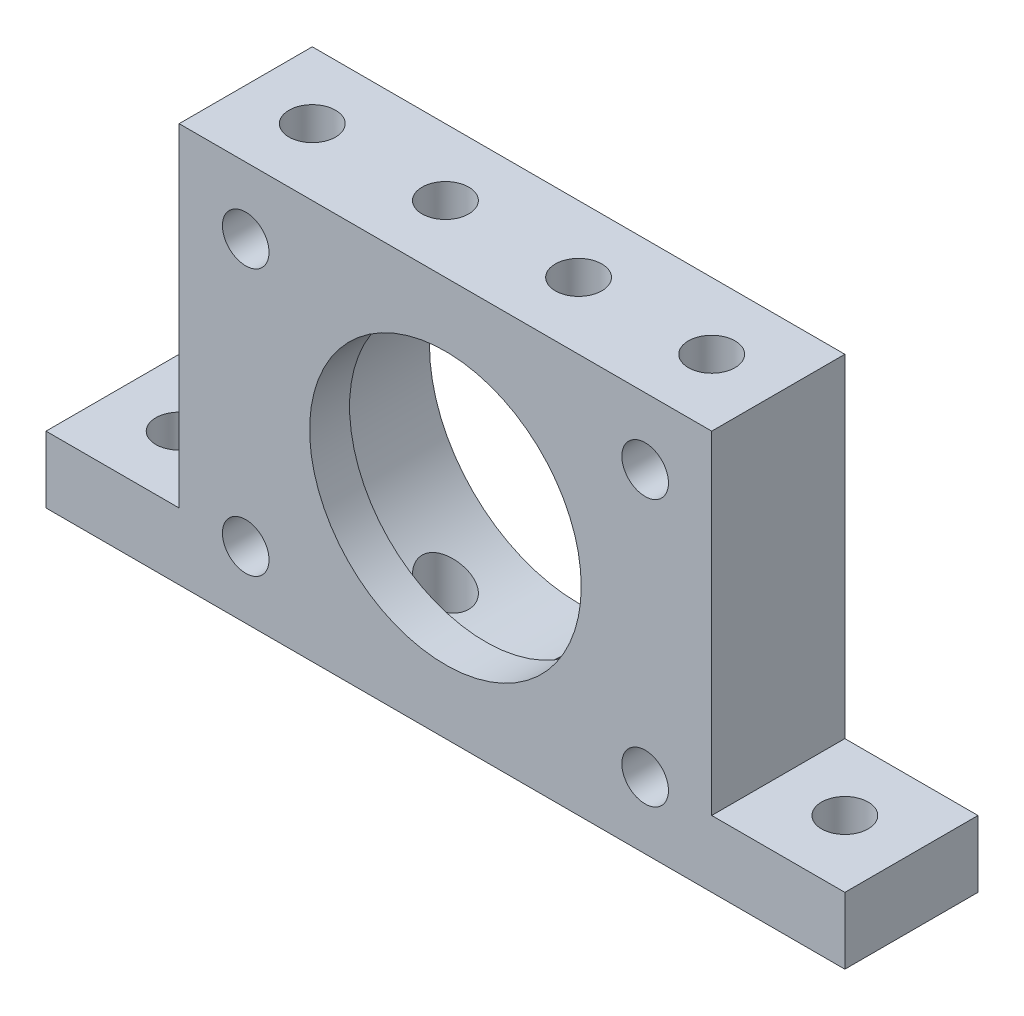
from build123d import *

# Parameters (mm, degrees)
ESQUISSE1_R             = 11.2
ESQUISSE1_R_2           = 1.75
BOSS_EXTRU_1_DEPTH      = 10
BOSS_EXTRU_2_START      = -3
ESQUISSE2_R             = 11.2
ESQUISSE2_R_2           = 10.2
BOSS_EXTRU_2_DEPTH      = 3
ESQUISSE3_R             = 1.75
ENL_V_MAT_EXTRU_1_DEPTH = 44.588989435


with BuildPart() as part:
    # Esquisse1 → Boss.-Extru.1 (new body)
    with BuildSketch(Plane.XY):
        Polygon((-20, -10), (-20, 15), (20, 15), (20, -10), (30, -10), (30, -15), (-30, -15), (-30, -10), align=None)
        Circle(ESQUISSE1_R, mode=Mode.SUBTRACT)
        with Locations((15, 10)):
            Circle(ESQUISSE1_R_2, mode=Mode.SUBTRACT)
        with Locations((-15, 10)):
            Circle(ESQUISSE1_R_2, mode=Mode.SUBTRACT)
        with Locations((-15, -10)):
            Circle(ESQUISSE1_R_2, mode=Mode.SUBTRACT)
        with Locations((15, -10)):
            Circle(ESQUISSE1_R_2, mode=Mode.SUBTRACT)
    extrude(amount=BOSS_EXTRU_1_DEPTH)

    # Esquisse2 → Boss.-Extru.2 (add)
    with BuildSketch(Plane.XY.offset(10).offset(BOSS_EXTRU_2_START)):
        Circle(ESQUISSE2_R)
        Circle(ESQUISSE2_R_2, mode=Mode.SUBTRACT)
    extrude(amount=BOSS_EXTRU_2_DEPTH)

    # Esquisse3 → Enlèv. mat.-Extru.1 (cut, through all)
    with BuildSketch(Plane.XZ.offset(15)):
        with Locations(Location((-25, 5, 0), (0, 0, 270))):
            Circle(ESQUISSE3_R)
        with Locations((-15, 5)):
            Circle(ESQUISSE3_R)
        with Locations(Location((-5, 5, 0), (0, 0, 270))):
            Circle(ESQUISSE3_R)
        with Locations(Location((5, 5, 0), (0, 0, 270))):
            Circle(ESQUISSE3_R)
        with Locations((15, 5)):
            Circle(ESQUISSE3_R)
        with Locations(Location((25, 5, 0), (0, 0, 270))):
            Circle(ESQUISSE3_R)
    extrude(amount=-ENL_V_MAT_EXTRU_1_DEPTH, mode=Mode.SUBTRACT)


solid = part.part
